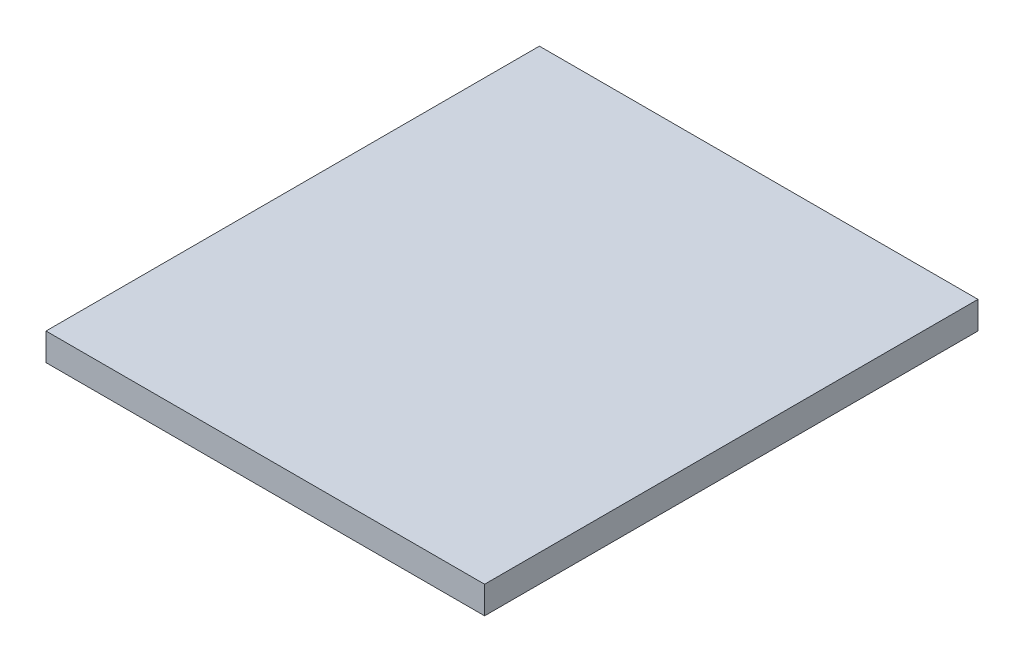
from build123d import *

# Parameters (mm, degrees)
SKETCH1_W           = 50.8
SKETCH1_H           = 57.15
BOSS_EXTRUDE1_DEPTH = 3.175


with BuildPart() as part:
    # Sketch1 → Boss-Extrude1 (new body)
    with BuildSketch(Plane(origin=(0, 0, 0), x_dir=(1, 0, 0), z_dir=(0, 1, 0))):
        with Locations((25.4, 28.575)):
            Rectangle(SKETCH1_W, SKETCH1_H)
    extrude(amount=BOSS_EXTRUDE1_DEPTH)


solid = part.part
